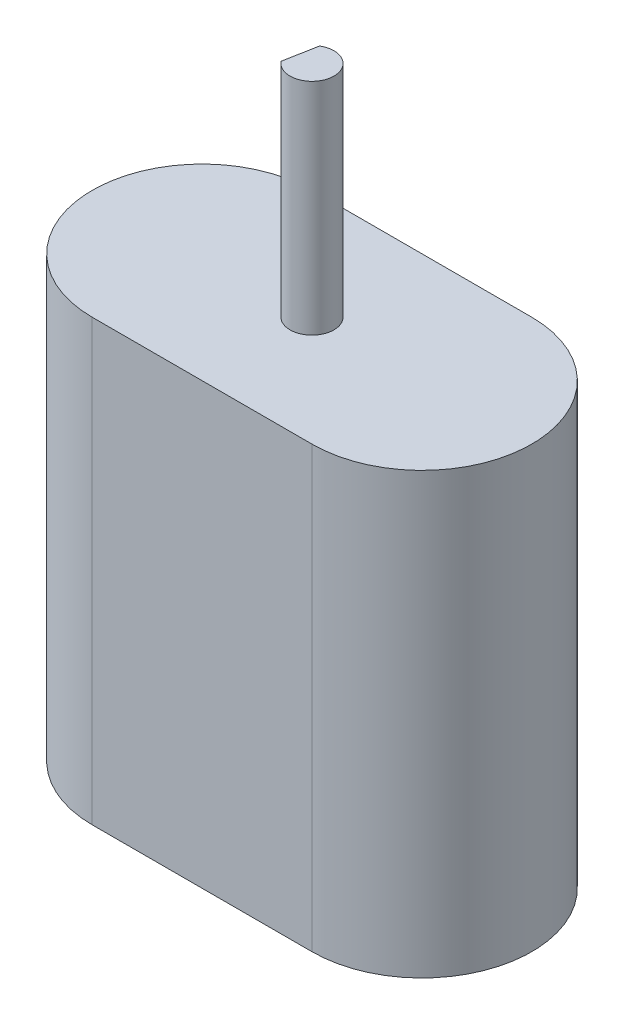
from build123d import *

# Parameters (mm, degrees)
BOSS_EXTRUDE1_DEPTH = 20
SKETCH4_R           = 1
BOSS_EXTRUDE2_DEPTH = 10
CUT_EXTRUDE1_START  = -10
CUT_EXTRUDE1_DEPTH  = 10


with BuildPart() as part:
    # Sketch1 → Boss-Extrude1 (new body)
    with BuildSketch(Plane(origin=(0, 0, 0), x_dir=(1, 0, 0), z_dir=(0, 1, 0))):
        with BuildLine():
            Line((0, 5), (10, 5))
            ThreePointArc((10, 5), (15, 0), (10, -5))
            Line((10, -5), (0, -5))
            ThreePointArc((0, -5), (-5, 0), (0, 5))
        make_face()
    extrude(amount=BOSS_EXTRUDE1_DEPTH)

    # Sketch4 → Boss-Extrude2 (add)
    with BuildSketch(Plane(origin=(0, 20, 0), x_dir=(1, 0, 0), z_dir=(0, 1, 0))):
        with Locations(Location((5, 0, 0), (0, 0, 270))):
            Circle(SKETCH4_R)
    extrude(amount=BOSS_EXTRUDE2_DEPTH)

    # Sketch5 → Cut-Extrude1 (cut)
    with BuildSketch(Plane(origin=(0, 30, 0), x_dir=(1, 0, 0), z_dir=(0, 1, 0)).offset(CUT_EXTRUDE1_START)):
        with BuildLine():
            Line((4.488521887, 0.859296305), (4.211378142, -0.614878497))
            ThreePointArc((4.211378142, -0.614878497), (4.017216799, 0.184762496), (4.488521887, 0.859296305))
        make_face()
    extrude(amount=CUT_EXTRUDE1_DEPTH, mode=Mode.SUBTRACT)


solid = part.part
